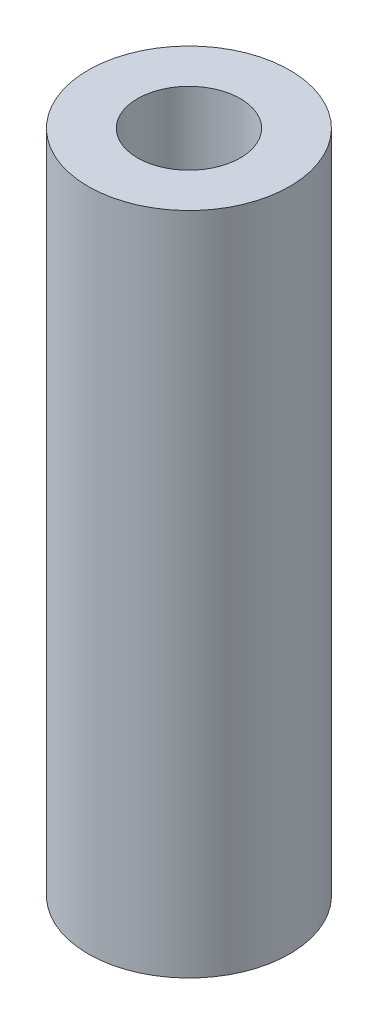
from build123d import *

# Parameters (mm, degrees)
SKETCH1_R           = 7.77875
SKETCH1_R_2         = 3.96875
BOSS_EXTRUDE1_DEPTH = 51.308


with BuildPart() as part:
    # Sketch1 → Boss-Extrude1 (new body)
    with BuildSketch(Plane(origin=(0, 0, 0), x_dir=(1, 0, 0), z_dir=(0, 1, 0))):
        with Locations(Location((0, 0, 0), (0, 0, 270))):
            Circle(SKETCH1_R)
        with Locations(Location((0, 0, 0), (0, 0, 270))):
            Circle(SKETCH1_R_2, mode=Mode.SUBTRACT)
    extrude(amount=BOSS_EXTRUDE1_DEPTH)


solid = part.part
